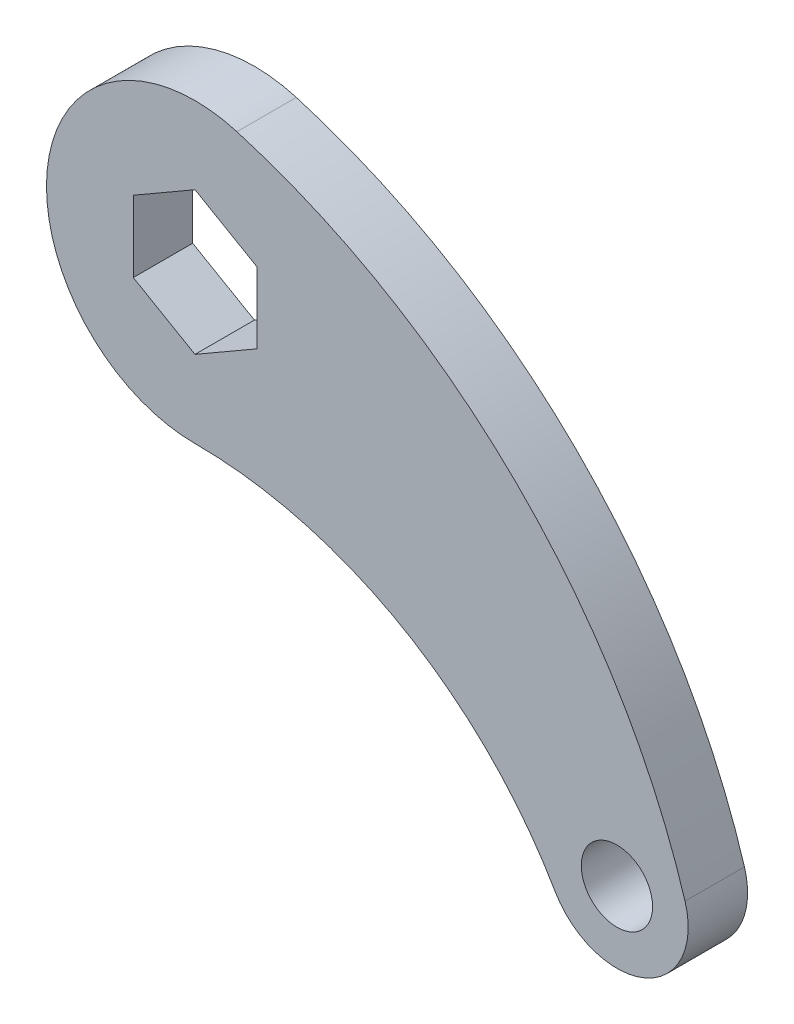
from build123d import *

# Parameters (mm, degrees)
SKETCH1_R           = 25
SKETCH1_R_2         = 12
SKETCH1_R_3         = 6
BOSS_EXTRUDE1_DEPTH = 10


with BuildPart() as part:
    # Sketch1 → Boss-Extrude1 (new body)
    # profile 1 of 3: a face of its own
    with BuildSketch(Plane.XY):
        with Locations((0, 95)):
            Circle(SKETCH1_R)
        Polygon((-10.392304845, 89), (0, 83), (10.392304845, 89), (10.392304845, 101), (0, 107), (-10.392304845, 101), align=None, mode=Mode.SUBTRACT)
    # profile 2 of 3: a face of its own
    with BuildSketch(Plane.XY):
        with BuildLine():
            ThreePointArc((0, 70), (35, 60.621778265), (60.621778265, 35))
            ThreePointArc((60.621778265, 35), (66.215959074, 51.999000215), (82.481329918, 44.535852182))
            ThreePointArc((82.481329918, 44.535852182), (54.13048872, 91.246307211), (7.053536481, 118.98432036))
            ThreePointArc((7.053536481, 118.98432036), (20.016723159, 109.977676522), (25, 95))
            ThreePointArc((25, 95), (17.67766953, 77.32233047), (0, 70))
        make_face()
    # profile 3 of 3: a face of its own
    with BuildSketch(Plane.XY):
        with Locations((71.01408311, 41)):
            Circle(SKETCH1_R_2)
        with Locations((71.01408311, 41)):
            Circle(SKETCH1_R_3, mode=Mode.SUBTRACT)
    extrude(amount=BOSS_EXTRUDE1_DEPTH)


solid = part.part
